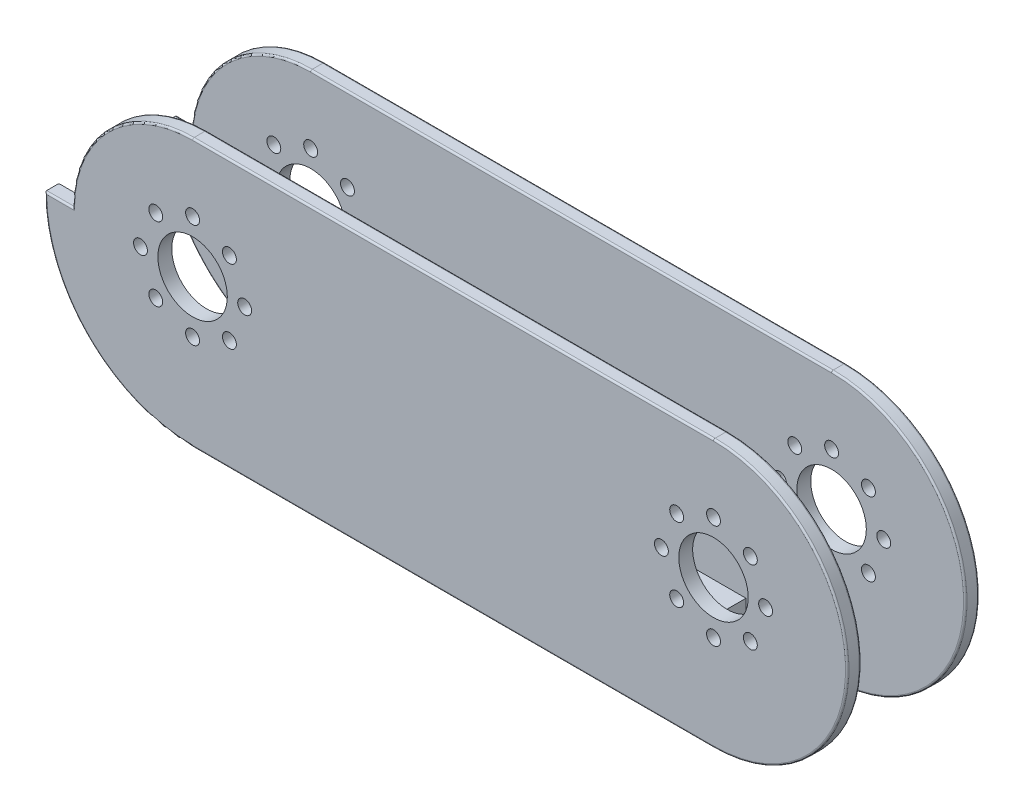
from build123d import *

# Parameters (mm, degrees)
SKETCH_1_R          = 10
EXTRUDE_1_DEPTH     = 19
CUT_EXTRUDE_2_DEPTH = 15
SKETCH_3_R          = 2
CUT_EXTRUDE_3_DEPTH = 19
SKETCH_4_R          = 2
CUT_EXTRUDE_4_DEPTH = 19
CUT_EXTRUDE_5_DEPTH = 42.5
CUT_EXTRUDE_6_DEPTH = 100
SKETCH_9_W          = 27.203931148
SKETCH_9_H          = 30
CUT_EXTRUDE_7_DEPTH = 100
SKETCH_10_W         = 9.651402854
SKETCH_10_H         = 30
CUT_EXTRUDE_8_DEPTH = 100
FILLET_1_R          = 0.5


with BuildPart() as part:
    # 草图1 → 凸台-拉伸1 (new, symmetric)
    with BuildSketch(Plane.XY):
        with BuildLine():
            Line((-34.5, 0), (-42.5, 0))
            ThreePointArc((-42.5, 0), (-30.0520382, -30.0520382), (0, -42.5))
            Line((0, -42.5), (150, -42.5))
            ThreePointArc((150, -42.5), (188.5, -4), (150, 34.5))
            Line((150, 34.5), (0, 34.5))
            ThreePointArc((0, 34.5), (-24.395183951, 24.395183951), (-34.5, 0))
        make_face()
        Circle(SKETCH_1_R, mode=Mode.SUBTRACT)
        with Locations((150, 0)):
            Circle(SKETCH_1_R, mode=Mode.SUBTRACT)
    extrude(amount=EXTRUDE_1_DEPTH, both=True)

    # 草图2 → 切除-拉伸2 (cut, symmetric)
    with BuildSketch(Plane.XY):
        with BuildLine():
            Line((0, -34.5), (150, -34.5))
            ThreePointArc((150, -34.5), (184.5, 0), (150, 34.5))
            Line((150, 34.5), (0, 34.5))
            ThreePointArc((0, 34.5), (-34.5, 0), (0, -34.5))
        make_face()
    extrude(amount=CUT_EXTRUDE_2_DEPTH, both=True, mode=Mode.SUBTRACT)

    # 草图3 → 切除-拉伸3 (cut, symmetric)
    with BuildSketch(Plane.XY):
        with Locations((-15, 0)):
            Circle(SKETCH_3_R)
        with Locations((-10.606601718, 10.606601718)):
            Circle(SKETCH_3_R)
        with Locations((0, 15)):
            Circle(SKETCH_3_R)
        with Locations((10.606601718, 10.606601718)):
            Circle(SKETCH_3_R)
        with Locations((15, 0)):
            Circle(SKETCH_3_R)
        with Locations((10.606601718, -10.606601718)):
            Circle(SKETCH_3_R)
        with Locations((0, -15)):
            Circle(SKETCH_3_R)
        with Locations((-10.606601718, -10.606601718)):
            Circle(SKETCH_3_R)
    extrude(amount=CUT_EXTRUDE_3_DEPTH, both=True, mode=Mode.SUBTRACT)

    # 草图4 → 切除-拉伸4 (cut, symmetric)
    with BuildSketch(Plane.XY):
        with Locations((135, 0)):
            Circle(SKETCH_4_R)
        with Locations((139.393398282, 10.606601718)):
            Circle(SKETCH_4_R)
        with Locations((150, 15)):
            Circle(SKETCH_4_R)
        with Locations((160.606601718, 10.606601718)):
            Circle(SKETCH_4_R)
        with Locations((165, 0)):
            Circle(SKETCH_4_R)
        with Locations((160.606601718, -10.606601718)):
            Circle(SKETCH_4_R)
        with Locations((150, -15)):
            Circle(SKETCH_4_R)
        with Locations((139.393398282, -10.606601718)):
            Circle(SKETCH_4_R)
    extrude(amount=CUT_EXTRUDE_4_DEPTH, both=True, mode=Mode.SUBTRACT)

    # 草图5 → 切除-拉伸5 (cut, symmetric)
    with BuildSketch(Plane(origin=(0, 0, 0), x_dir=(1, 0, 0), z_dir=(0, 1, 0))):
        Polygon((150, -15), (188.5, -15), (188.5, 15), (150, 15), (135, 15), (135, -15), (149.638400331, -15), align=None)
    extrude(amount=CUT_EXTRUDE_5_DEPTH, both=True, mode=Mode.SUBTRACT)

    # 草图8 → 切除-拉伸6 (cut)
    with BuildSketch(Plane(origin=(0, 0, 0), x_dir=(1, 0, 0), z_dir=(0, 1, 0))):
        Polygon((0, 15), (0, -15), (-42.5, -15), (-42.5, 15), (-34.5, 15), align=None)
    extrude(amount=-CUT_EXTRUDE_6_DEPTH, mode=Mode.SUBTRACT)

    # 草图9 → 切除-拉伸7 (cut)
    with BuildSketch(Plane(origin=(0, 0, 0), x_dir=(1, 0, 0), z_dir=(0, 1, 0))):
        with Locations((13.601965574, 0)):
            Rectangle(SKETCH_9_W, SKETCH_9_H)
    extrude(amount=-CUT_EXTRUDE_7_DEPTH, mode=Mode.SUBTRACT)

    # 草图10 → 切除-拉伸8 (cut)
    with BuildSketch(Plane(origin=(0, 0, 0), x_dir=(1, 0, 0), z_dir=(0, 1, 0))):
        with Locations((130.174298573, 0)):
            Rectangle(SKETCH_10_W, SKETCH_10_H)
    extrude(amount=-CUT_EXTRUDE_8_DEPTH, mode=Mode.SUBTRACT)

    # 圆角1
    fillet_1_edges = [part.edges().sort_by_distance(p)[0] for p in [
        (-38.5, 0, -19),
        (-24.395183951, 24.395183951, -19),
        (75, 34.5, -19),
        (188.5, -4, -19),
        (75, -42.5, -19),
        (-30.0520382, -30.0520382, -19),
        (75, -42.5, 19),
        (188.5, -4, 19),
        (188.5, -4, 15),
        (13.601965574, -42.5, 15),
        (188.5, -4, -15),
        (13.601965574, -42.5, -15),
        (75, 34.5, 19),
        (-24.395183951, 24.395183951, 19),
        (-38.5, 0, -15),
        (-30.0520382, -30.0520382, 15),
        (-30.0520382, -30.0520382, -15),
        (-38.5, 0, 19),
        (-24.395183951, 24.395183951, -15),
        (75, 34.5, -15),
        (-24.395183951, 24.395183951, 15),
        (27.203931148, -42.5, 0),
        (75, 34.5, 15),
        (125.348597146, -42.5, 0),
        (-30.0520382, -30.0520382, 19),
    ]]
    fillet(fillet_1_edges, radius=FILLET_1_R)


solid = part.part
